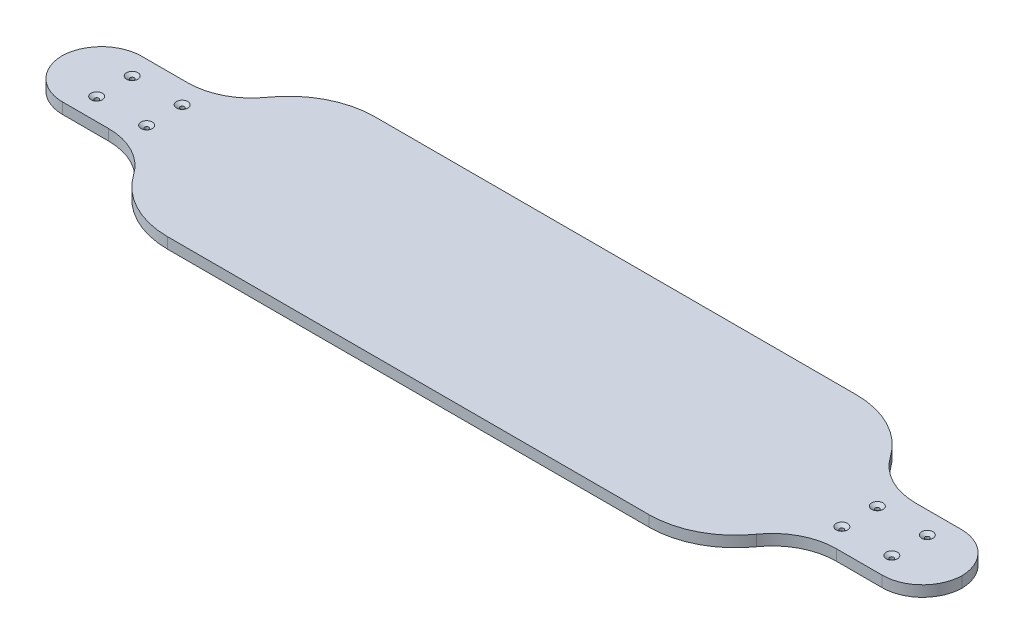
from build123d import *

# Parameters (mm, degrees)
SKETCH1_R           = 2.38
BOSS_EXTRUDE1_DEPTH = 12.64
CHAMFER1_SIZE       = 4.2291
CHAMFER1_SIZE2      = 2.94


with BuildPart() as part:
    # Sketch1 → Boss-Extrude1 (new body)
    with BuildSketch(Plane(origin=(0, 0, 0), x_dir=(1, 0, 0), z_dir=(0, 1, 0))):
        with BuildLine():
            Line((279.847634913, -120.65), (-279.847634913, -120.65))
            ThreePointArc((-279.847634913, -120.65), (-326.268482654, -109.291064504), (-362.199527238, -77.781057273))
            ThreePointArc((-362.199527238, -77.781057273), (-388.816521313, -54.439078616), (-423.204150273, -46.024608002))
            Line((-423.204150273, -46.024608002), (-476.469252285, -46.024608002))
            ThreePointArc((-476.469252285, -46.024608002), (-509.344325494, -32.599702877), (-523.424733457, 0))
            ThreePointArc((-523.424733457, 0), (-509.344325494, 32.599702877), (-476.469252285, 46.024608002))
            Line((-476.469252285, 46.024608002), (-423.204150273, 46.024608002))
            ThreePointArc((-423.204150273, 46.024608002), (-388.816521313, 54.439078616), (-362.199527238, 77.781057273))
            ThreePointArc((-362.199527238, 77.781057273), (-326.268482654, 109.291064504), (-279.847634913, 120.65))
            Line((-279.847634913, 120.65), (279.847634913, 120.65))
            ThreePointArc((279.847634913, 120.65), (326.268482654, 109.291064504), (362.199527238, 77.781057273))
            ThreePointArc((362.199527238, 77.781057273), (388.816521313, 54.439078616), (423.204150273, 46.024608002))
            Line((423.204150273, 46.024608002), (476.469252285, 46.024608002))
            ThreePointArc((476.469252285, 46.024608002), (509.344325494, 32.599702877), (523.424733457, 0))
            ThreePointArc((523.424733457, 0), (509.344325494, -32.599702877), (476.469252285, -46.024608002))
            Line((476.469252285, -46.024608002), (423.204150273, -46.024608002))
            ThreePointArc((423.204150273, -46.024608002), (388.816521313, -54.439078616), (362.199527238, -77.781057273))
            ThreePointArc((362.199527238, -77.781057273), (326.268482654, -109.291064504), (279.847634913, -120.65))
        make_face()
        with Locations(Location((-404.164718127, 20.6375, 0), (0, 0, 90))):
            Circle(SKETCH1_R, mode=Mode.SUBTRACT)
        with Locations(Location((-462.266329753, 20.6375, 0), (0, 0, 90))):
            Circle(SKETCH1_R, mode=Mode.SUBTRACT)
        with Locations(Location((-404.164718127, -20.6375, 0), (0, 0, 90))):
            Circle(SKETCH1_R, mode=Mode.SUBTRACT)
        with Locations(Location((-462.266329753, -20.6375, 0), (0, 0, 90))):
            Circle(SKETCH1_R, mode=Mode.SUBTRACT)
        with Locations(Location((462.266329753, -20.6375, 0), (0, 0, 90))):
            Circle(SKETCH1_R, mode=Mode.SUBTRACT)
        with Locations(Location((404.164718127, -20.6375, 0), (0, 0, 90))):
            Circle(SKETCH1_R, mode=Mode.SUBTRACT)
        with Locations(Location((462.266329753, 20.6375, 0), (0, 0, 90))):
            Circle(SKETCH1_R, mode=Mode.SUBTRACT)
        with Locations(Location((404.164718127, 20.6375, 0), (0, 0, 90))):
            Circle(SKETCH1_R, mode=Mode.SUBTRACT)
    extrude(amount=BOSS_EXTRUDE1_DEPTH)

    # Chamfer1
    chamfer1_edges = [part.edges().sort_by_distance(p)[0] for p in [
        (-462.266329753, 12.64, -18.2575),
        (-404.164718127, 12.64, 23.0175),
        (-462.266329753, 12.64, 23.0175),
        (-404.164718127, 12.64, -18.2575),
        (462.266329753, 12.64, 23.0175),
        (404.164718127, 12.64, 23.0175),
        (462.266329753, 12.64, -18.2575),
        (404.164718127, 12.64, -18.2575),
    ]]
    chamfer1_side = [part.faces().sort_by_distance(p)[0] for p in [
        (0, 12.64, 0),
    ]]
    chamfer(chamfer1_edges, length=CHAMFER1_SIZE, length2=CHAMFER1_SIZE2, reference=chamfer1_side[0])


solid = part.part
